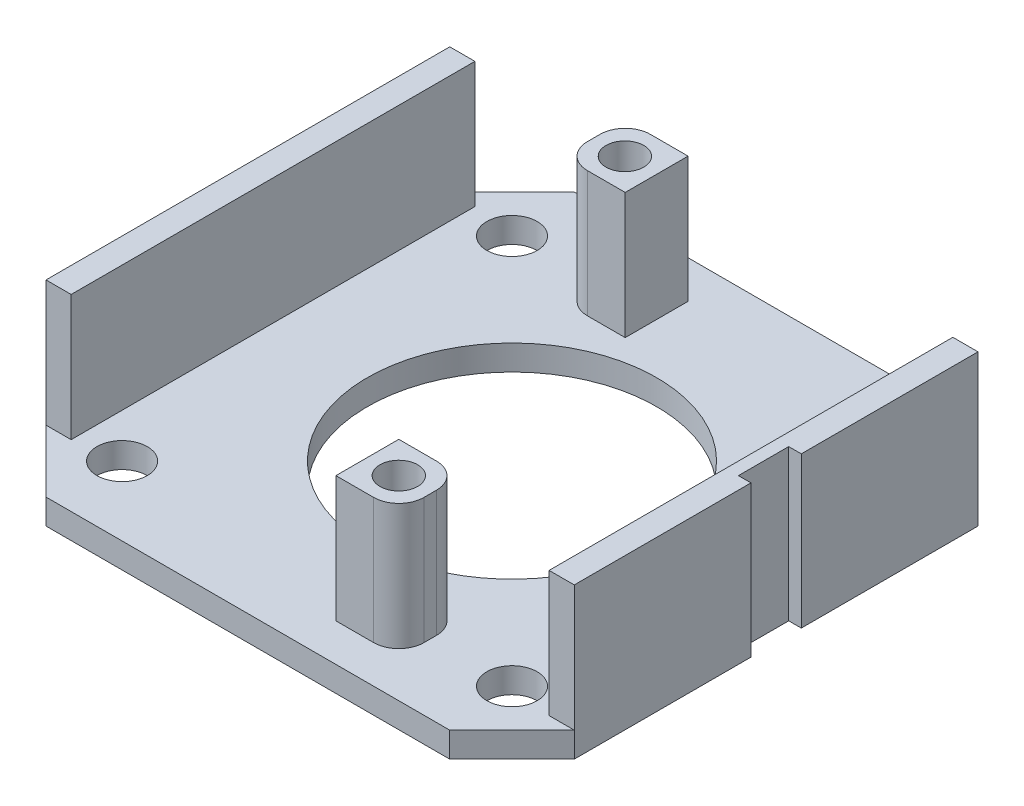
from build123d import *

# Parameters (mm, degrees)
SKETCH1_W           = 42
SKETCH1_H           = 42
BOSS_EXTRUDE1_DEPTH = 2
SKETCH2_R           = 11.5
CUT_EXTRUDE1_DEPTH  = 30.765752132
SKETCH3_R           = 2
CUT_EXTRUDE2_DEPTH  = 30.765752132
CUT_EXTRUDE3_DEPTH  = 30.765752132
SKETCH5_W           = 2
SKETCH5_H           = 32.100505064
BOSS_EXTRUDE2_DEPTH = 10
SKETCH6_W           = 5
SKETCH6_H           = 5
BOSS_EXTRUDE3_DEPTH = 10
SKETCH9_W           = 4
SKETCH9_H           = 12
CUT_EXTRUDE4_DEPTH  = 1
SKETCH11_R          = 1.5
CUT_EXTRUDE5_DEPTH  = 4
FILLET1_R           = 2


with BuildPart() as part:
    # Sketch1 → Boss-Extrude1 (new body)
    with BuildSketch(Plane(origin=(0, 0, 0), x_dir=(1, 0, 0), z_dir=(0, 1, 0))):
        Rectangle(SKETCH1_W, SKETCH1_H)
    extrude(amount=BOSS_EXTRUDE1_DEPTH)

    # Sketch2 → Cut-Extrude1 (cut, through all)
    with BuildSketch(Plane(origin=(0, 2, 0), x_dir=(1, 0, 0), z_dir=(0, 1, 0))):
        with Locations(Location((0, 0, 0), (0, 0, 270))):
            Circle(SKETCH2_R)
    extrude(amount=-CUT_EXTRUDE1_DEPTH, mode=Mode.SUBTRACT)

    # Sketch3 → Cut-Extrude2 (cut, through all)
    with BuildSketch(Plane(origin=(0, 2, 0), x_dir=(1, 0, 0), z_dir=(0, 1, 0))):
        with Locations(Location((-15.5, 15.5, 0), (0, 0, 270))):
            Circle(SKETCH3_R)
        with Locations(Location((15.5, 15.5, 0), (0, 0, 270))):
            Circle(SKETCH3_R)
        with Locations(Location((15.5, -15.5, 0), (0, 0, 270))):
            Circle(SKETCH3_R)
        with Locations(Location((-15.5, -15.5, 0), (0, 0, 270))):
            Circle(SKETCH3_R)
    extrude(amount=-CUT_EXTRUDE2_DEPTH, mode=Mode.SUBTRACT)

    # Sketch4 → Cut-Extrude3 (cut, through all)
    with BuildSketch(Plane(origin=(0, 2, 0), x_dir=(1, 0, 0), z_dir=(0, 1, 0))):
        Polygon((-21, 16.050252532), (-16.050252532, 21), (-21, 21), align=None)
        Polygon((-21, -21), (-16.050252532, -21), (-21, -16.050252532), align=None)
        Polygon((21, -21), (16.050252532, -21), (21, -16.050252532), align=None)
        Polygon((16.050252532, 21), (21, 16.050252532), (21, 21), align=None)
    extrude(amount=-CUT_EXTRUDE3_DEPTH, mode=Mode.SUBTRACT)

    # Sketch5 → Boss-Extrude2 (add)
    with BuildSketch(Plane(origin=(0, 2, 0), x_dir=(1, 0, 0), z_dir=(0, 1, 0))):
        with Locations((-20, 0)):
            Rectangle(SKETCH5_W, SKETCH5_H)
        with Locations((20, 0)):
            Rectangle(SKETCH5_W, SKETCH5_H)
    extrude(amount=BOSS_EXTRUDE2_DEPTH)

    # Sketch6 → Boss-Extrude3 (add)
    with BuildSketch(Plane(origin=(0, 2, 0), x_dir=(1, 0, 0), z_dir=(0, 1, 0))):
        with Locations((6.5, -15.5)):
            Rectangle(SKETCH6_W, SKETCH6_H)
        with Locations((-6.5, 15.5)):
            Rectangle(SKETCH6_W, SKETCH6_H)
    extrude(amount=BOSS_EXTRUDE3_DEPTH)

    # Sketch9 → Cut-Extrude4 (cut)
    with BuildSketch(Plane(origin=(21, 0, 0), x_dir=(0, 0, -1), z_dir=(1, 0, 0))):
        with Locations((0, 6)):
            Rectangle(SKETCH9_W, SKETCH9_H)
    extrude(amount=-CUT_EXTRUDE4_DEPTH, mode=Mode.SUBTRACT)

    # Sketch11 → Cut-Extrude5 (cut)
    with BuildSketch(Plane(origin=(0, 12, 0), x_dir=(1, 0, 0), z_dir=(0, 1, 0))):
        with Locations(Location((-6.5, 15.474657956, 0), (0, 0, 270))):
            Circle(SKETCH11_R)
        with Locations(Location((6.5, -15.5, 0), (0, 0, 270))):
            Circle(SKETCH11_R)
    extrude(amount=-CUT_EXTRUDE5_DEPTH, mode=Mode.SUBTRACT)

    # Fillet1
    fillet1_edges = [part.edges().sort_by_distance(p)[0] for p in [
        (9, 7, 18),
        (9, 7, 13),
        (-9, 7, -18),
        (-9, 7, -13),
    ]]
    fillet(fillet1_edges, radius=FILLET1_R)


solid = part.part
